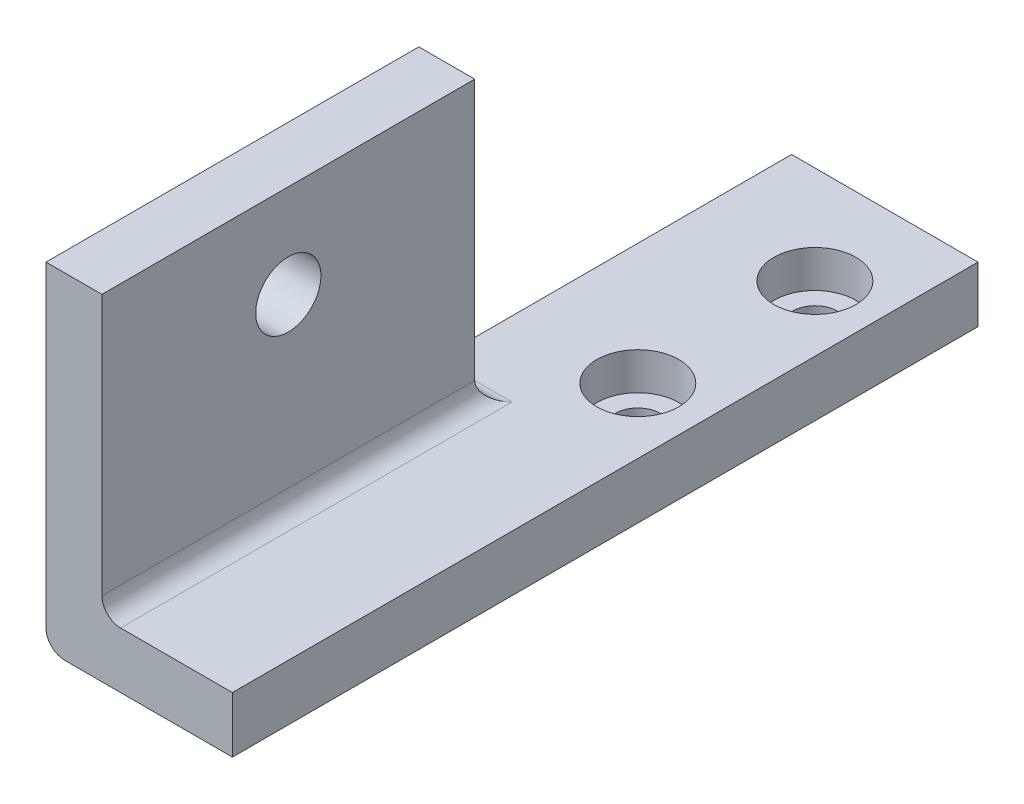
from build123d import *

# Parameters (mm, degrees)
SKETCH1_W                      = 10
SKETCH1_H                      = 20
SKETCH1_R                      = 1.175
BOSS_EXTRUDE1_DEPTH            = 3
CBORE_FOR_M2_SHCS1_D           = 2.4
CBORE_FOR_M2_SHCS1_CBORE_D     = 4.4
CBORE_FOR_M2_SHCS1_CBORE_DEPTH = 2
SKETCH6_W                      = 10
SKETCH6_H                      = 3
BOSS_EXTRUDE2_DEPTH            = 20
SKETCH8_W                      = 3
SKETCH8_H                      = 20
BOSS_EXTRUDE3_DEPTH            = 15
SKETCH9_R                      = 1.75
CUT_EXTRUDE1_DEPTH             = 28.802877549
FILLET1_R                      = 1
FILLET2_R                      = 1


with BuildPart() as part:
    # Sketch1 → Boss-Extrude1 (new body)
    with BuildSketch(Plane(origin=(0, 0, 0), x_dir=(1, 0, 0), z_dir=(0, 1, 0))):
        with Locations((5, 10)):
            Rectangle(SKETCH1_W, SKETCH1_H)
        with Locations(Location((6.5, 5.25, 0), (0, 0, 270))):
            Circle(SKETCH1_R, mode=Mode.SUBTRACT)
        with Locations(Location((6.5, 14.75, 0), (0, 0, 270))):
            Circle(SKETCH1_R, mode=Mode.SUBTRACT)
    extrude(amount=BOSS_EXTRUDE1_DEPTH)

    # CBORE for M2 SHCS1 (through all)
    with Locations(Plane(origin=(0, 3, 0), x_dir=(1, 0, 0), z_dir=(0, 1, 0))):
        with Locations((6.5, 14.75), (6.5, 5.25)):
            CounterBoreHole(CBORE_FOR_M2_SHCS1_D / 2, CBORE_FOR_M2_SHCS1_CBORE_D / 2, CBORE_FOR_M2_SHCS1_CBORE_DEPTH)

    # Sketch6 → Boss-Extrude2 (add)
    with BuildSketch(Plane(origin=(0, 0, 0), x_dir=(-1, 0, 0), z_dir=(0, 0, -1))):
        with Locations((-5, 1.5)):
            Rectangle(SKETCH6_W, SKETCH6_H)
    extrude(amount=-BOSS_EXTRUDE2_DEPTH)

    # Sketch8 → Boss-Extrude3 (add)
    with BuildSketch(Plane(origin=(0, 3, 0), x_dir=(1, 0, 0), z_dir=(0, 1, 0))):
        with Locations((1.5, -10)):
            Rectangle(SKETCH8_W, SKETCH8_H)
    extrude(amount=BOSS_EXTRUDE3_DEPTH)

    # Sketch9 → Cut-Extrude1 (cut, through all)
    with BuildSketch(Plane(origin=(3, 0, 0), x_dir=(0, 0, -1), z_dir=(1, 0, 0))):
        with Locations((-10, 13)):
            Circle(SKETCH9_R)
    extrude(amount=-CUT_EXTRUDE1_DEPTH, mode=Mode.SUBTRACT)

    # Fillet1
    fillet1_edges = [part.edges().sort_by_distance(p)[0] for p in [
        (3, 3, 10),
        (1.5, 3, 0),
    ]]
    fillet(fillet1_edges, radius=FILLET1_R)

    # Fillet2
    fillet2_edges = [part.edges().sort_by_distance(p)[0] for p in [
        (0, 0, 0),
    ]]
    fillet(fillet2_edges, radius=FILLET2_R)


solid = part.part
